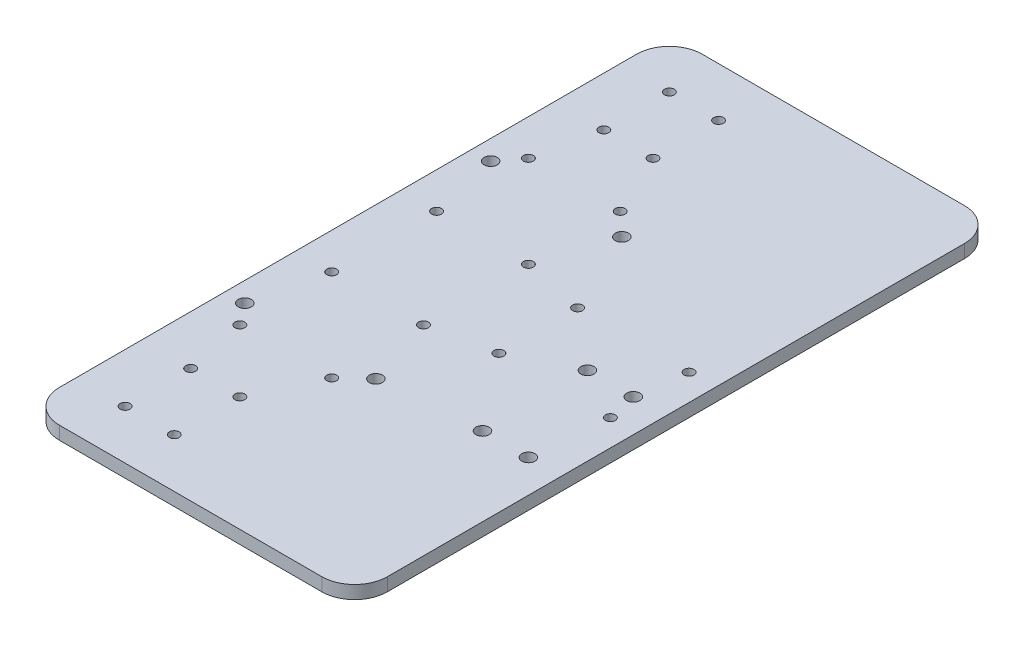
from build123d import *

# Parameters (mm, degrees)
SKETCH_1_W                  = 100
SKETCH_1_H                  = 160
EXTRUDE_1_DEPTH             = 4
SKETCH_2_R                  = 2
CUT_EXTRUDE_1_DEPTH         = 4
SKETCH_3_R                  = 1.5
CUT_EXTRUDE_2_DEPTH         = 4
SKETCH_4_R                  = 1.5
CUT_EXTRUDE_3_DEPTH         = 4
SKETCH_6_W                  = 100
SKETCH_6_H                  = 4
EXTRUDE_2_DEPTH             = 18
SKETCH_5_R                  = 1.5
CUT_EXTRUDE_4_DEPTH         = 10
PATTERN_LINEAR_1_COUNT      = 2
PATTERN_LINEAR_1_PITCH      = 20
PATTERN_LINEAR_1_COUNT_DIR2 = 2
PATTERN_LINEAR_1_PITCH_DIR2 = 15
MIRROR_3_COPY_1_SKETCH_R    = 1.5
MIRROR_3_COPY_1_DEPTH       = 10
MIRROR_3_COPY_2_SKETCH_R    = 1.5
MIRROR_3_COPY_2_DEPTH       = 10
MIRROR_3_COPY_3_SKETCH_R    = 1.5
MIRROR_3_COPY_3_DEPTH       = 10
FILLET_1_R                  = 10
SKETCH_7_R                  = 2
CUT_EXTRUDE_5_DEPTH         = 10


with BuildPart() as part:
    # 草图1 → 凸台-拉伸1 (new body)
    with BuildSketch(Plane(origin=(0, 0, 0), x_dir=(1, 0, 0), z_dir=(0, 1, 0))):
        Rectangle(SKETCH_1_W, SKETCH_1_H)
    extrude(amount=EXTRUDE_1_DEPTH)

    # 草图2 → 切除-拉伸1 (cut)
    with BuildSketch(Plane(origin=(0, 4, 0), x_dir=(1, 0, 0), z_dir=(0, 1, 0))):
        with Locations(Location((40, -3, 0), (0, 0, 270))):
            Circle(SKETCH_2_R)
        with Locations(Location((26, -3, 0), (0, 0, 270))):
            Circle(SKETCH_2_R)
        with Locations(Location((40, -35, 0), (0, 0, 90))):
            Circle(SKETCH_2_R)
        with Locations(Location((26, -35, 0), (0, 0, 90))):
            Circle(SKETCH_2_R)
    extrude(amount=-CUT_EXTRUDE_1_DEPTH, mode=Mode.SUBTRACT)

    # 草图3 → 切除-拉伸2 (cut)
    with BuildSketch(Plane(origin=(0, 4, 0), x_dir=(1, 0, 0), z_dir=(0, 1, 0))):
        with Locations(Location((-39, 44, 0), (0, 0, 270))):
            Circle(SKETCH_3_R)
        with Locations(Location((-11, 44, 0), (0, 0, 270))):
            Circle(SKETCH_3_R)
        with Locations(Location((-11, 16, 0), (0, 0, 270))):
            Circle(SKETCH_3_R)
        with Locations(Location((-39, 16, 0), (0, 0, 270))):
            Circle(SKETCH_3_R)
    cut_extrude_2 = extrude(amount=-CUT_EXTRUDE_2_DEPTH, mode=Mode.SUBTRACT)

    # 镜向1: 切除-拉伸2 across plane
    add(cut_extrude_2.mirror(Plane.XY), mode=Mode.SUBTRACT)

    # 草图4 → 切除-拉伸3 (cut)
    with BuildSketch(Plane(origin=(0, 4, 0), x_dir=(1, 0, 0), z_dir=(0, 1, 0))):
        with Locations(Location((42, 12, 0), (0, 0, 270))):
            Circle(SKETCH_4_R)
        with Locations(Location((8, 12, 0), (0, 0, 90))):
            Circle(SKETCH_4_R)
        with Locations(Location((42, -12, 0), (0, 0, 90))):
            Circle(SKETCH_4_R)
        with Locations(Location((8, -12, 0), (0, 0, 270))):
            Circle(SKETCH_4_R)
    extrude(amount=-CUT_EXTRUDE_3_DEPTH, mode=Mode.SUBTRACT)

    # 草图6 → 凸台-拉伸2 (add)
    with BuildSketch(Plane(origin=(0, 0, -80), x_dir=(-1, 0, 0), z_dir=(0, 0, -1))):
        with Locations((0, 2)):
            Rectangle(SKETCH_6_W, SKETCH_6_H)
    extrude_2 = extrude(amount=EXTRUDE_2_DEPTH)

    # 草图5 → 切除-拉伸4 (cut)
    with BuildSketch(Plane(origin=(0, 4, 0), x_dir=(1, 0, 0), z_dir=(0, 1, 0))):
        with Locations(Location((-35, 83, 0), (0, 0, 270))):
            Circle(SKETCH_5_R)
    cut_extrude_4 = extrude(amount=-CUT_EXTRUDE_4_DEPTH, mode=Mode.SUBTRACT)

    # 镜向2: 凸台-拉伸2 across plane
    add(extrude_2.mirror(Plane.XY))

    # 阵列(线性)1: Cut-Extrude 4 2 × 2
    with Locations(*[(j * PATTERN_LINEAR_1_PITCH_DIR2, 0, i * PATTERN_LINEAR_1_PITCH) for i in range(PATTERN_LINEAR_1_COUNT) for j in range(PATTERN_LINEAR_1_COUNT_DIR2) if (i, j) != (0, 0)]):
        add(cut_extrude_4, mode=Mode.SUBTRACT)

    # 镜向3: 切除-拉伸4 across plane
    add(cut_extrude_4.mirror(Plane.XY), mode=Mode.SUBTRACT)

    # 镜向3 copy 1 sketch → 镜向3 copy 1 (cut)
    with BuildSketch(Plane(origin=(15, 4, 0), x_dir=(1, 0, 0), z_dir=(0, 1, 0))):
        with Locations((-35, -83)):
            Circle(MIRROR_3_COPY_1_SKETCH_R)
    extrude(amount=-MIRROR_3_COPY_1_DEPTH, mode=Mode.SUBTRACT)

    # 镜向3 copy 2 sketch → 镜向3 copy 2 (cut)
    with BuildSketch(Plane(origin=(0, 4, -20), x_dir=(1, 0, 0), z_dir=(0, 1, 0))):
        with Locations((-35, -83)):
            Circle(MIRROR_3_COPY_2_SKETCH_R)
    extrude(amount=-MIRROR_3_COPY_2_DEPTH, mode=Mode.SUBTRACT)

    # 镜向3 copy 3 sketch → 镜向3 copy 3 (cut)
    with BuildSketch(Plane(origin=(15, 4, -20), x_dir=(1, 0, 0), z_dir=(0, 1, 0))):
        with Locations((-35, -83)):
            Circle(MIRROR_3_COPY_3_SKETCH_R)
    extrude(amount=-MIRROR_3_COPY_3_DEPTH, mode=Mode.SUBTRACT)

    # 圆角1
    fillet_1_edges = [part.edges().sort_by_distance(p)[0] for p in [
        (50, 2, 98),
        (-50, 2, 98),
        (50, 2, -98),
        (-50, 2, -98),
    ]]
    fillet(fillet_1_edges, radius=FILLET_1_R)

    # 草图7 → 切除-拉伸5 (cut)
    with BuildSketch(Plane(origin=(0, 4, 0), x_dir=(1, 0, 0), z_dir=(0, 1, 0))):
        with Locations(Location((-44, 37.5, 0), (0, 0, 270))):
            Circle(SKETCH_7_R)
        with Locations(Location((-4, 37.5, 0), (0, 0, 270))):
            Circle(SKETCH_7_R)
        with Locations(Location((-4, -37.5, 0), (0, 0, 270))):
            Circle(SKETCH_7_R)
        with Locations(Location((-44, -37.5, 0), (0, 0, 270))):
            Circle(SKETCH_7_R)
    extrude(amount=-CUT_EXTRUDE_5_DEPTH, mode=Mode.SUBTRACT)


solid = part.part
